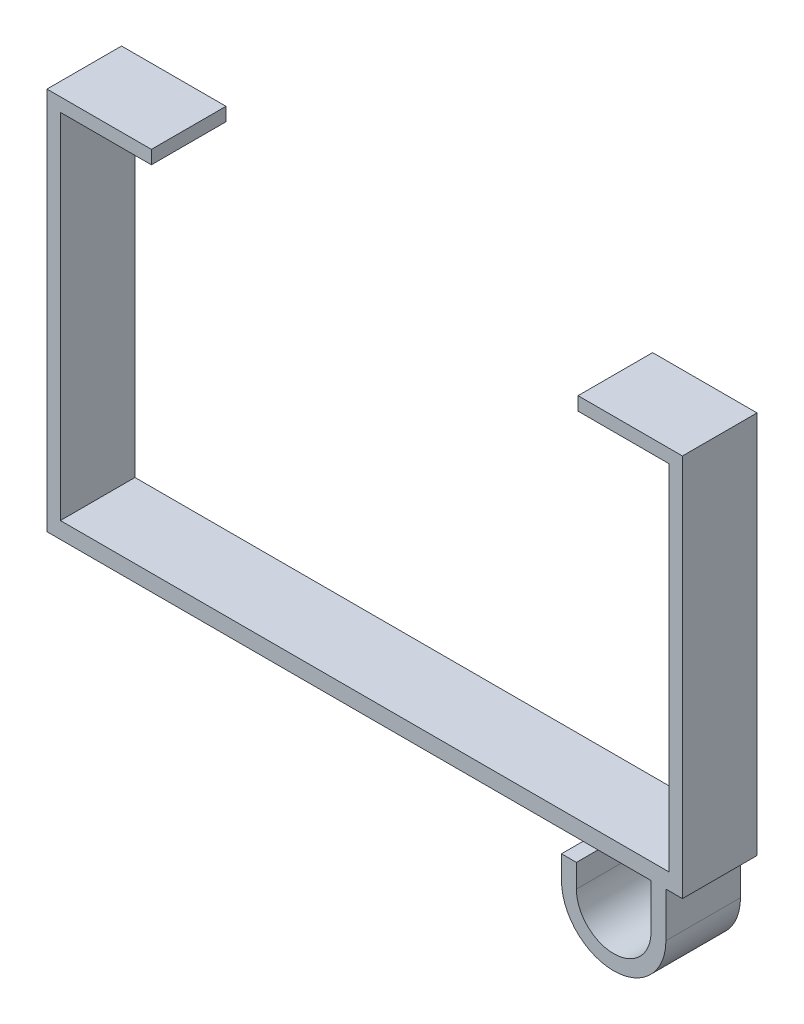
from build123d import *

# Parameters (mm, degrees)
BOSS_EXTRUDE1_DEPTH = 5
BOSS_EXTRUDE2_DEPTH = 5


with BuildPart() as part:
    # Sketch1 → Boss-Extrude1 (new body)
    with BuildSketch(Plane.XY):
        Polygon((-20.4, 11.95), (-14.3, 11.95), (-14.3, 12.85), (-21.3, 12.85), (-21.3, -12.85), (13.190689839, -12.85), (14.190689839, -12.85), (19.190689839, -12.85), (20.190689839, -12.85), (21.3, -12.85), (21.3, 12.85), (14.3, 12.85), (14.3, 11.95), (20.4, 11.95), (20.4, -11.75), (-20.4, -11.75), align=None)
    extrude(amount=BOSS_EXTRUDE1_DEPTH)

    # Sketch1<3> → Boss-Extrude2 (add)
    with BuildSketch(Plane.XY):
        with BuildLine():
            Line((14.190689839, -14.299541794), (13.190689839, -14.299541794))
            Line((13.190689839, -14.299541794), (13.190689839, -15.85))
            ThreePointArc((13.190689839, -15.85), (16.690689839, -19.35), (20.190689839, -15.85))
            Line((20.190689839, -15.85), (20.190689839, -12.85))
            Line((20.190689839, -12.85), (19.190689839, -12.85))
            Line((19.190689839, -12.85), (19.190689839, -15.85))
            ThreePointArc((19.190689839, -15.85), (16.690689839, -18.35), (14.190689839, -15.85))
            Line((14.190689839, -15.85), (14.190689839, -14.299541794))
        make_face()
    extrude(amount=BOSS_EXTRUDE2_DEPTH)


solid = part.part
